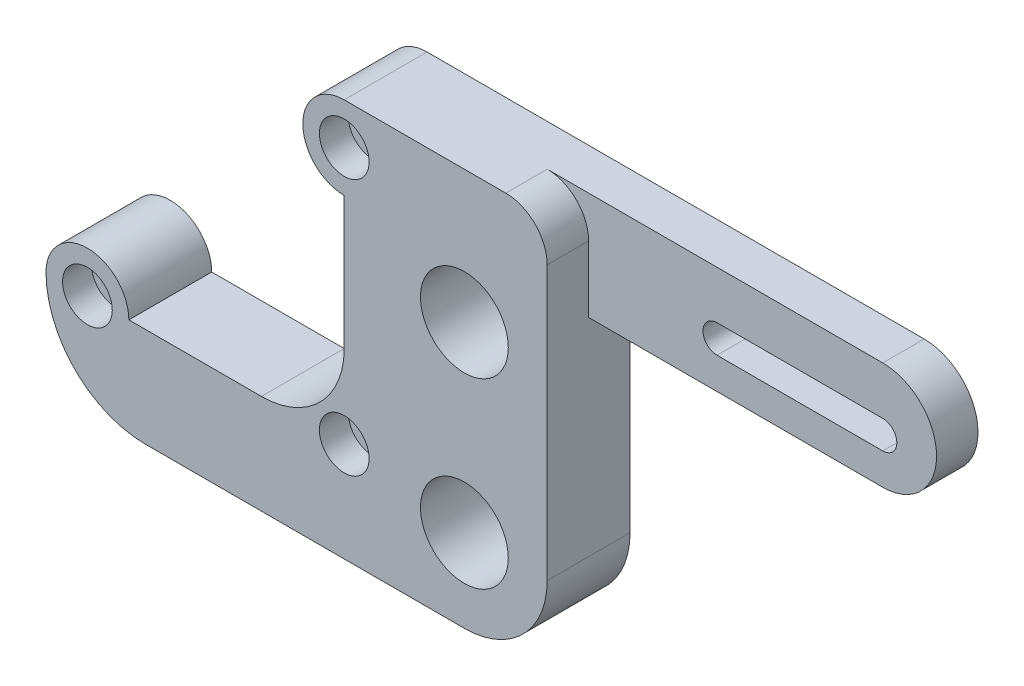
from build123d import *

# Parameters (mm, degrees)
SKETCH1_R           = 1.8
SKETCH1_R_2         = 5.3
BOSS_EXTRUDE1_DEPTH = 10
SKETCH2_R           = 3
CUT_EXTRUDE1_DEPTH  = 3.5
CUT_EXTRUDE2_START  = -5
CUT_EXTRUDE2_DEPTH  = 5


with BuildPart() as part:
    # Sketch1 → Boss-Extrude1 (new body)
    with BuildSketch(Plane.XY):
        with BuildLine():
            Line((0, 5), (60, 5))
            ThreePointArc((60, 5), (66.5, -1.5), (60, -8))
            Line((60, -8), (24.5, -8))
            Line((24.5, -8), (24.5, -33))
            ThreePointArc((24.5, -33), (21.571067812, -40.071067812), (14.5, -43))
            Line((14.5, -43), (-24, -43))
            ThreePointArc((-24, -43), (-32.485281374, -39.485281374), (-36, -31))
            ThreePointArc((-36, -31), (-31, -26), (-26, -31))
            Line((-26, -31), (-10, -31))
            ThreePointArc((-10, -31), (-2.928932188, -28.071067812), (0, -21))
            Line((0, -21), (0, -5))
            ThreePointArc((0, -5), (-5, 0), (0, 5))
        make_face()
        Circle(SKETCH1_R, mode=Mode.SUBTRACT)
        with Locations((14.5, -33)):
            Circle(SKETCH1_R_2, mode=Mode.SUBTRACT)
        with Locations((14.5, -11)):
            Circle(SKETCH1_R_2, mode=Mode.SUBTRACT)
        with Locations((0, -31)):
            Circle(SKETCH1_R, mode=Mode.SUBTRACT)
        with Locations((-31, -31)):
            Circle(SKETCH1_R, mode=Mode.SUBTRACT)
        with BuildLine():
            Line((60, -4.2), (40, -4.2))
            ThreePointArc((40, -4.2), (38.3, -2.5), (40, -0.8))
            Line((40, -0.8), (60, -0.8))
            ThreePointArc((60, -0.8), (61.7, -2.5), (60, -4.2))
        make_face(mode=Mode.SUBTRACT)
    extrude(amount=BOSS_EXTRUDE1_DEPTH)

    # Sketch2 → Cut-Extrude1 (cut)
    with BuildSketch(Plane.XY.offset(10)):
        with Locations((-31, -31)):
            Circle(SKETCH2_R)
        with Locations((0, -31)):
            Circle(SKETCH2_R)
        Circle(SKETCH2_R)
    extrude(amount=-CUT_EXTRUDE1_DEPTH, mode=Mode.SUBTRACT)

    # Sketch3 → Cut-Extrude2 (cut)
    with BuildSketch(Plane.XY.offset(10).offset(CUT_EXTRUDE2_START)):
        with BuildLine():
            Line((24.5, -8), (24.5, 0))
            ThreePointArc((24.5, 0), (23.035533906, 3.535533906), (19.5, 5))
            Line((19.5, 5), (60, 5))
            ThreePointArc((60, 5), (66.5, -1.5), (60, -8))
            Line((60, -8), (24.5, -8))
        make_face()
    extrude(amount=CUT_EXTRUDE2_DEPTH, mode=Mode.SUBTRACT)


solid = part.part
